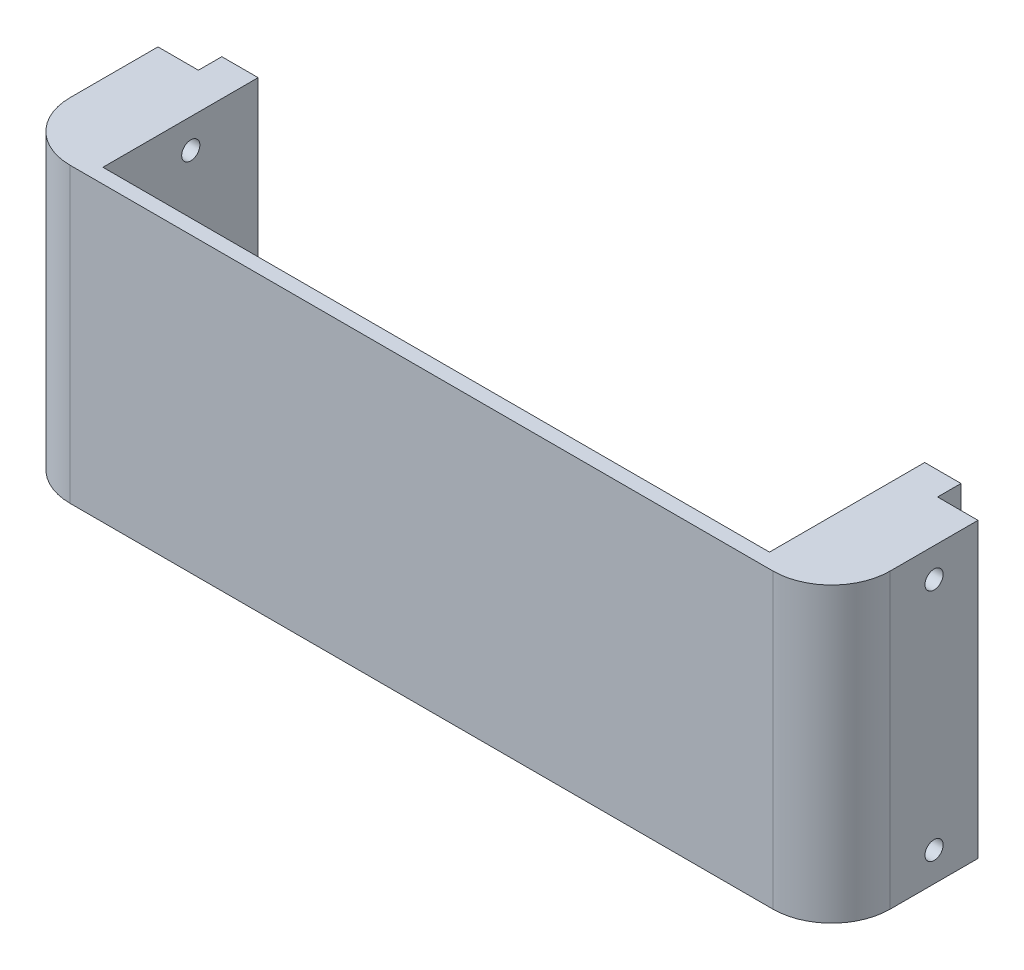
from build123d import *

# Parameters (mm, degrees)
EXTRUDE_1_DEPTH     = 14
CUT_EXTRUDE_1_DEPTH = 44
SKETCH_3_W          = 6.2
SKETCH_3_H          = 6.2
CUT_EXTRUDE_2_DEPTH = 4
SKETCH_4_R          = 4
CUT_EXTRUDE_3_DEPTH = 5
SKETCH_5_R          = 2.6
CUT_EXTRUDE_4_DEPTH = 5
SKETCH_6_R          = 4
EXTRUDE_2_DEPTH     = 10
SKETCH_7_W          = 6.2
SKETCH_7_H          = 4
EXTRUDE_3_DEPTH     = 40
CUT_EXTRUDE_5_DEPTH = 50
SKETCH_9_W          = 20
SKETCH_9_H          = 25
EXTRUDE_4_DEPTH     = 44
CUT_EXTRUDE_6_DEPTH = 44
EXTRUDE_5_DEPTH     = 44
SKETCH_12_W         = 6.9
SKETCH_12_H         = 22.5
CUT_EXTRUDE_7_DEPTH = 50
EXTRUDE_START       = 6
EXTRUDE_6_DEPTH     = 6
SKETCH_15_R         = 1.55
CUT_EXTRUDE_8_DEPTH = 2000


with BuildPart() as part:
    # 草图1 → 凸台-拉伸1 (new body)
    with BuildSketch(Plane.XY):
        Polygon((-15, 22), (-15, -22), (15, -22), (15, 22), (0, 22), align=None)
    extrude(amount=EXTRUDE_1_DEPTH)

    # 草图2 → 切除-拉伸1 (cut)
    with BuildSketch(Plane(origin=(0, 22, 0), x_dir=(1, 0, 0), z_dir=(0, 1, 0))):
        Polygon((-15, 0), (-15, -14), (-10, -4), (-3.1, -4), (-3.1, 0), align=None)
        Polygon((3.1, -4), (10, -4), (15, -14), (15, 0), (3.1, 0), align=None)
    extrude(amount=-CUT_EXTRUDE_1_DEPTH, mode=Mode.SUBTRACT)

    # 草图3 → 切除-拉伸2 (cut)
    with BuildSketch(Plane(origin=(0, 0, 0), x_dir=(-1, 0, 0), z_dir=(0, 0, -1))):
        Rectangle(SKETCH_3_W, SKETCH_3_H)
    extrude(amount=-CUT_EXTRUDE_2_DEPTH, mode=Mode.SUBTRACT)

    # 草图4 → 切除-拉伸3 (cut)
    with BuildSketch(Plane.XY.offset(14)):
        Circle(SKETCH_4_R)
    extrude(amount=-CUT_EXTRUDE_3_DEPTH, mode=Mode.SUBTRACT)

    # 草图5 → 切除-拉伸4 (cut)
    with BuildSketch(Plane.XY.offset(9)):
        Circle(SKETCH_5_R)
    extrude(amount=-CUT_EXTRUDE_4_DEPTH, mode=Mode.SUBTRACT)

    # 草图6 → 凸台-拉伸2 (add)
    with BuildSketch(Plane.XY.offset(14)):
        Circle(SKETCH_6_R)
    extrude(amount=-EXTRUDE_2_DEPTH)

    # 草图7 → 凸台-拉伸3 (add)
    with BuildSketch(Plane(origin=(0, -22, 0), x_dir=(-1, 0, 0), z_dir=(0, -1, 0))):
        with Locations((0, -2)):
            Rectangle(SKETCH_7_W, SKETCH_7_H)
    extrude(amount=-EXTRUDE_3_DEPTH)

    # 草图8 → 切除-拉伸5 (cut)
    with BuildSketch(Plane.XZ.offset(22)):
        Polygon((-15, 14), (-10, 4), (-10, 14), align=None)
        Polygon((15, 14), (10, 14), (10, 4), align=None)
    extrude(amount=-CUT_EXTRUDE_5_DEPTH, mode=Mode.SUBTRACT)

    # 草图9 → 凸台-拉伸4 (add)
    with BuildSketch(Plane.XZ.offset(22)):
        with Locations((0, 16.5)):
            Rectangle(SKETCH_9_W, SKETCH_9_H)
    extrude(amount=-EXTRUDE_4_DEPTH)

    # 草图10 → 切除-拉伸6 (cut)
    with BuildSketch(Plane.XZ.offset(22)):
        with BuildLine():
            Line((-10, 29), (-10, 19))
            ThreePointArc((-10, 19), (-7.071067812, 26.071067812), (0, 29))
            Line((0, 29), (-10, 29))
        make_face()
    extrude(amount=-CUT_EXTRUDE_6_DEPTH, mode=Mode.SUBTRACT)

    # 草图11 → 凸台-拉伸5 (add)
    with BuildSketch(Plane.XZ.offset(22)):
        with BuildLine():
            Line((120, 0), (123.1, 0))
            Line((123.1, 0), (123.1, 4))
            Line((123.1, 4), (130, 4))
            Line((130, 4), (130, 19))
            ThreePointArc((130, 19), (127.071067812, 26.071067812), (120, 29))
            Line((120, 29), (110, 29))
            Line((110, 29), (10, 29))
            Line((10, 29), (10, 26.5))
            Line((10, 26.5), (110, 26.5))
            Line((110, 26.5), (110, 4))
            Line((110, 4), (116.9, 4))
            Line((116.9, 4), (116.9, 0))
            Line((116.9, 0), (120, 0))
        make_face()
    extrude(amount=-EXTRUDE_5_DEPTH)

    # 草图12 → 切除-拉伸7 (cut)
    with BuildSketch(Plane(origin=(0, 22, 0), x_dir=(1, 0, 0), z_dir=(0, 1, 0))):
        with Locations((6.55, -15.25)):
            Rectangle(SKETCH_12_W, SKETCH_12_H)
        with Locations((113.45, -15.25)):
            Rectangle(SKETCH_12_W, SKETCH_12_H)
    extrude(amount=-CUT_EXTRUDE_7_DEPTH, mode=Mode.SUBTRACT)

    # 草图14 → 凸台-拉伸6 (add)
    with BuildSketch(Plane(origin=(0, -22, 0), x_dir=(-1, 0, 0), z_dir=(0, -1, 0)).offset(EXTRUDE_START)):
        with BuildLine():
            Line((3.1, 0), (3.1, -4))
            Line((3.1, -4), (10, -4))
            Line((10, -4), (10, -19))
            ThreePointArc((10, -19), (7.071067812, -26.071067812), (0, -29))
            Line((0, -29), (-120, -29))
            ThreePointArc((-120, -29), (-127.071067812, -26.071067812), (-130, -19))
            Line((-130, -19), (-130, -4))
            Line((-130, -4), (-123.1, -4))
            Line((-123.1, -4), (-123.1, 0))
            Line((-123.1, 0), (-116.9, 0))
            Line((-116.9, 0), (-116.9, -26.5))
            Line((-116.9, -26.5), (-3.1, -26.5))
            Line((-3.1, -26.5), (-3.1, 0))
            Line((-3.1, 0), (3.1, 0))
        make_face()
    extrude(amount=-EXTRUDE_6_DEPTH)

    # 草图15 → 切除-拉伸8 (cut)
    with BuildSketch(Plane.ZY.offset(10)):
        with Locations(Location((11.5, 17, 0), (0, 0, 270))):
            Circle(SKETCH_15_R)
        with Locations(Location((11.5, -23, 0), (0, 0, 270))):
            Circle(SKETCH_15_R)
    extrude(amount=-CUT_EXTRUDE_8_DEPTH, mode=Mode.SUBTRACT)


solid = part.part
